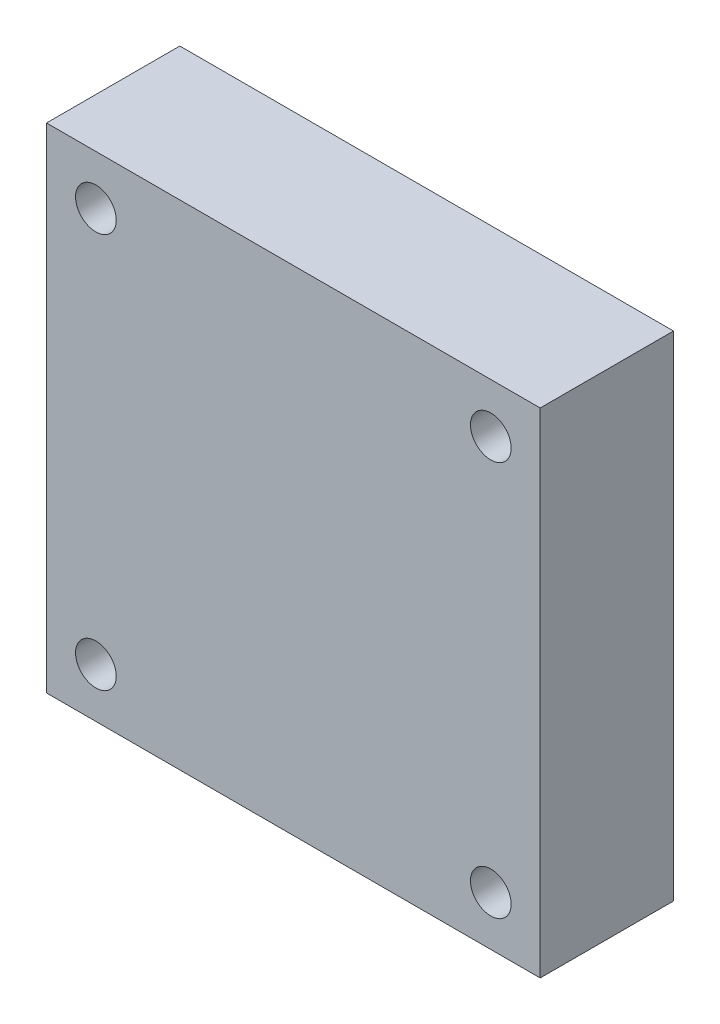
from build123d import *

# Parameters (mm, degrees)
SKETCH1_W           = 40
SKETCH1_H           = 40
BOSS_EXTRUDE1_DEPTH = 10.8
SKETCH2_R           = 1.65
CUT_EXTRUDE1_DEPTH  = 58.590276957


with BuildPart() as part:
    # Sketch1 → Boss-Extrude1 (new body)
    with BuildSketch(Plane.XY):
        with Locations((20, 20)):
            Rectangle(SKETCH1_W, SKETCH1_H)
    extrude(amount=BOSS_EXTRUDE1_DEPTH)

    # Sketch2 → Cut-Extrude1 (cut, through all)
    with BuildSketch(Plane.XY.offset(10.8)):
        with Locations((4, 36)):
            Circle(SKETCH2_R)
        with Locations((36, 36)):
            Circle(SKETCH2_R)
        with Locations((4, 4)):
            Circle(SKETCH2_R)
        with Locations((36, 4)):
            Circle(SKETCH2_R)
    extrude(amount=-CUT_EXTRUDE1_DEPTH, mode=Mode.SUBTRACT)


solid = part.part
